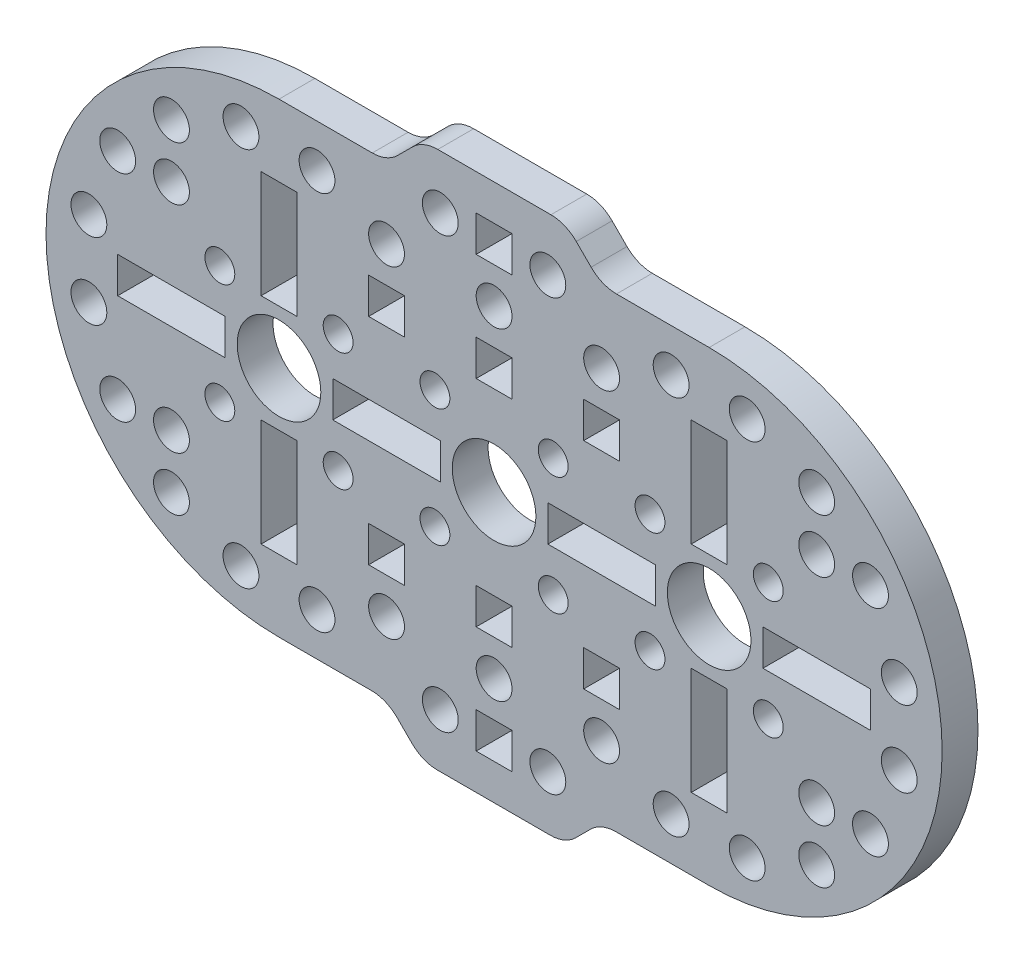
from build123d import *

# Parameters (mm, degrees)
MODEL_R                 = 1.25
MODEL_R_2               = 3.5
MODEL_R_3               = 1.5
MODEL_W                 = 9
MODEL_H                 = 3
MODEL_W_2               = 3
MODEL_H_2               = 9
SALIENTE_EXTRUIR1_DEPTH = 3


with BuildPart() as part:
    # Model → Saliente-Extruir1 (new body)
    with BuildSketch(Plane.XY):
        with BuildLine():
            Line((63.795544402, 295.852296768), (56.038185089, 295.852296768))
            ThreePointArc((56.038185089, 295.852296768), (54.890134792, 296.080658171), (53.916864745, 296.730976425))
            Line((53.916864745, 296.730976425), (52.674224058, 297.973617112))
            ThreePointArc((52.674224058, 297.973617112), (51.700954012, 298.623935366), (50.552903715, 298.852296768))
            Line((50.552903715, 298.852296768), (41.085229894, 298.852296768))
            ThreePointArc((41.085229894, 298.852296768), (39.937179597, 298.623935366), (38.96390955, 297.973617112))
            Line((38.96390955, 297.973617112), (37.721268863, 296.730976425))
            ThreePointArc((37.721268863, 296.730976425), (36.747998817, 296.080658171), (35.59994852, 295.852296768))
            Line((35.59994852, 295.852296768), (27.795544402, 295.852296768))
            ThreePointArc((27.795544402, 295.852296768), (8.295544402, 276.352296768), (27.795544402, 256.852296768))
            Line((27.795544402, 256.852296768), (35.552903715, 256.852296768))
            ThreePointArc((35.552903715, 256.852296768), (36.700954012, 256.623935366), (37.674224058, 255.973617112))
            Line((37.674224058, 255.973617112), (38.916864745, 254.730976425))
            ThreePointArc((38.916864745, 254.730976425), (39.890134792, 254.080658171), (41.038185089, 253.852296768))
            Line((41.038185089, 253.852296768), (50.50585891, 253.852296768))
            ThreePointArc((50.50585891, 253.852296768), (51.653909207, 254.080658171), (52.627179253, 254.730976425))
            Line((52.627179253, 254.730976425), (53.86981994, 255.973617112))
            ThreePointArc((53.86981994, 255.973617112), (54.843089987, 256.623935366), (55.991140284, 256.852296768))
            Line((55.991140284, 256.852296768), (63.795544402, 256.852296768))
            ThreePointArc((63.795544402, 256.852296768), (83.295544402, 276.352296768), (63.795544402, 295.852296768))
        make_face()
        with Locations((22.845796934, 281.302044237)):
            Circle(MODEL_R, mode=Mode.SUBTRACT)
        with Locations((22.845796934, 271.4025493)):
            Circle(MODEL_R, mode=Mode.SUBTRACT)
        with Locations((32.74529187, 271.4025493)):
            Circle(MODEL_R, mode=Mode.SUBTRACT)
        with Locations((32.74529187, 281.302044237)):
            Circle(MODEL_R, mode=Mode.SUBTRACT)
        with Locations((27.795544402, 276.352296768)):
            Circle(MODEL_R_2, mode=Mode.SUBTRACT)
        with Locations((18.795544402, 289.852296768)):
            Circle(MODEL_R_3, mode=Mode.SUBTRACT)
        with Locations((18.795544402, 262.852296768)):
            Circle(MODEL_R_3, mode=Mode.SUBTRACT)
        with Locations((36.795544402, 289.852296768)):
            Circle(MODEL_R_3, mode=Mode.SUBTRACT)
        with Locations((36.795544402, 262.852296768)):
            Circle(MODEL_R_3, mode=Mode.SUBTRACT)
        with Locations((14.295544402, 267.352296768)):
            Circle(MODEL_R_3, mode=Mode.SUBTRACT)
        with Locations((14.295544402, 285.352296768)):
            Circle(MODEL_R_3, mode=Mode.SUBTRACT)
        with Locations((30.977524917, 292.262199345)):
            Circle(MODEL_R_3, mode=Mode.SUBTRACT)
        with Locations((24.613563886, 260.442394192)):
            Circle(MODEL_R_3, mode=Mode.SUBTRACT)
        with Locations((30.977524917, 260.442394192)):
            Circle(MODEL_R_3, mode=Mode.SUBTRACT)
        with Locations((24.613563886, 292.262199345)):
            Circle(MODEL_R_3, mode=Mode.SUBTRACT)
        with Locations((11.885641825, 279.534277284)):
            Circle(MODEL_R_3, mode=Mode.SUBTRACT)
        with Locations((11.885641825, 273.170316253)):
            Circle(MODEL_R_3, mode=Mode.SUBTRACT)
        with Locations((58.845796933, 281.302044237)):
            Circle(MODEL_R, mode=Mode.SUBTRACT)
        with Locations((58.845796933, 271.4025493)):
            Circle(MODEL_R, mode=Mode.SUBTRACT)
        with Locations((68.74529187, 271.4025493)):
            Circle(MODEL_R, mode=Mode.SUBTRACT)
        with Locations((68.74529187, 281.302044237)):
            Circle(MODEL_R, mode=Mode.SUBTRACT)
        with Locations((54.795544402, 289.852296768)):
            Circle(MODEL_R_3, mode=Mode.SUBTRACT)
        with Locations((54.795544402, 262.852296768)):
            Circle(MODEL_R_3, mode=Mode.SUBTRACT)
        with Locations((72.795544402, 289.852296768)):
            Circle(MODEL_R_3, mode=Mode.SUBTRACT)
        with Locations((72.795544402, 262.852296768)):
            Circle(MODEL_R_3, mode=Mode.SUBTRACT)
        with Locations((77.295544402, 267.352296768)):
            Circle(MODEL_R_3, mode=Mode.SUBTRACT)
        with Locations((77.295544402, 285.352296768)):
            Circle(MODEL_R_3, mode=Mode.SUBTRACT)
        with Locations((66.977524917, 292.262199345)):
            Circle(MODEL_R_3, mode=Mode.SUBTRACT)
        with Locations((60.613563886, 260.442394192)):
            Circle(MODEL_R_3, mode=Mode.SUBTRACT)
        with Locations((66.977524917, 260.442394192)):
            Circle(MODEL_R_3, mode=Mode.SUBTRACT)
        with Locations((60.613563886, 292.262199345)):
            Circle(MODEL_R_3, mode=Mode.SUBTRACT)
        with Locations((79.705446979, 273.170316253)):
            Circle(MODEL_R_3, mode=Mode.SUBTRACT)
        with Locations((79.705446979, 279.534277284)):
            Circle(MODEL_R_3, mode=Mode.SUBTRACT)
        with Locations((63.795544402, 276.352296768)):
            Circle(MODEL_R_2, mode=Mode.SUBTRACT)
        with Locations((18.795544402, 285.352296768)):
            Circle(MODEL_R_3, mode=Mode.SUBTRACT)
        with Locations((18.795544402, 267.352296768)):
            Circle(MODEL_R_3, mode=Mode.SUBTRACT)
        with Locations((72.795544402, 285.352296768)):
            Circle(MODEL_R_3, mode=Mode.SUBTRACT)
        with Locations((72.795544402, 267.352296768)):
            Circle(MODEL_R_3, mode=Mode.SUBTRACT)
        with Locations((40.845796933, 281.302044237)):
            Circle(MODEL_R, mode=Mode.SUBTRACT)
        with Locations((40.845796933, 271.4025493)):
            Circle(MODEL_R, mode=Mode.SUBTRACT)
        with Locations((50.74529187, 271.4025493)):
            Circle(MODEL_R, mode=Mode.SUBTRACT)
        with Locations((50.74529187, 281.302044237)):
            Circle(MODEL_R, mode=Mode.SUBTRACT)
        with Locations((45.795544402, 276.352296768)):
            Circle(MODEL_R_2, mode=Mode.SUBTRACT)
        with Locations((41.295544402, 294.352296768)):
            Circle(MODEL_R_3, mode=Mode.SUBTRACT)
        with Locations((50.295544402, 294.352296768)):
            Circle(MODEL_R_3, mode=Mode.SUBTRACT)
        with Locations((45.795544402, 289.852296768)):
            Circle(MODEL_R_3, mode=Mode.SUBTRACT)
        with Locations((41.295544402, 258.352296768)):
            Circle(MODEL_R_3, mode=Mode.SUBTRACT)
        with Locations((50.295544402, 258.352296768)):
            Circle(MODEL_R_3, mode=Mode.SUBTRACT)
        with Locations((45.795544402, 262.852296768)):
            Circle(MODEL_R_3, mode=Mode.SUBTRACT)
        with Locations((36.795544402, 276.352296768)):
            Rectangle(MODEL_W, MODEL_H, mode=Mode.SUBTRACT)
        with Locations((27.795544402, 285.352296768)):
            Rectangle(MODEL_W_2, MODEL_H_2, mode=Mode.SUBTRACT)
        with Locations((18.795544402, 276.352296768)):
            Rectangle(MODEL_W, MODEL_H, mode=Mode.SUBTRACT)
        with Locations((27.795544402, 267.352296768)):
            Rectangle(MODEL_W_2, MODEL_H_2, mode=Mode.SUBTRACT)
        with Locations((72.795544402, 276.352296768)):
            Rectangle(MODEL_W, MODEL_H, mode=Mode.SUBTRACT)
        with Locations((63.795544402, 285.352296768)):
            Rectangle(MODEL_W_2, MODEL_H_2, mode=Mode.SUBTRACT)
        with Locations((54.795544402, 276.352296768)):
            Rectangle(MODEL_W, MODEL_H, mode=Mode.SUBTRACT)
        with Locations((63.795544402, 267.352296768)):
            Rectangle(MODEL_W_2, MODEL_H_2, mode=Mode.SUBTRACT)
        with Locations((36.795544402, 285.352296768)):
            Rectangle(MODEL_W_2, MODEL_H, mode=Mode.SUBTRACT)
        with Locations((45.795544402, 285.352296768)):
            Rectangle(MODEL_W_2, MODEL_H, mode=Mode.SUBTRACT)
        with Locations((54.795544402, 285.352296768)):
            Rectangle(MODEL_W_2, MODEL_H, mode=Mode.SUBTRACT)
        with Locations((36.795544402, 267.352296768)):
            Rectangle(MODEL_W_2, MODEL_H, mode=Mode.SUBTRACT)
        with Locations((45.795544402, 267.352296768)):
            Rectangle(MODEL_W_2, MODEL_H, mode=Mode.SUBTRACT)
        with Locations((54.795544402, 267.352296768)):
            Rectangle(MODEL_W_2, MODEL_H, mode=Mode.SUBTRACT)
        with Locations((45.795544402, 294.352296768)):
            Rectangle(MODEL_W_2, MODEL_H, mode=Mode.SUBTRACT)
        with Locations((45.795544402, 258.352296768)):
            Rectangle(MODEL_W_2, MODEL_H, mode=Mode.SUBTRACT)
    extrude(amount=SALIENTE_EXTRUIR1_DEPTH)


solid = part.part
